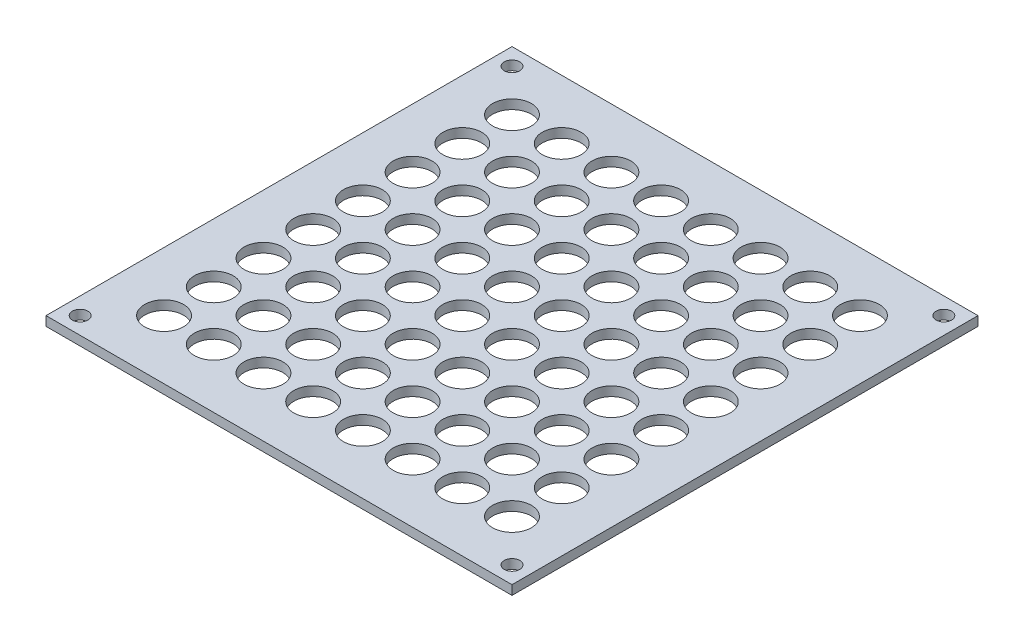
from build123d import *

# Parameters (mm, degrees)
ESBO_O1_W                = 300
ESBO_O1_H                = 300
RESSALTO_EXTRUS_O1_DEPTH = 6
ESBO_O2_R                = 5
CORTE_EXTRUS_O1_DEPTH    = 213.216870206
ESBO_O3_R                = 12.5
CORTE_EXTRUS_O2_DEPTH    = 213.216870206


with BuildPart() as part:
    # Esboço1 → Ressalto-extrusão1 (new body)
    with BuildSketch(Plane(origin=(0, 0, 0), x_dir=(1, 0, 0), z_dir=(0, 1, 0))):
        Rectangle(ESBO_O1_W, ESBO_O1_H)
    extrude(amount=RESSALTO_EXTRUS_O1_DEPTH)

    # Esboço2 → Corte-extrusão1 (cut, through all)
    with BuildSketch(Plane(origin=(0, 6, 0), x_dir=(1, 0, 0), z_dir=(0, 1, 0))):
        with Locations(Location((-139, 139, 0), (0, 0, 270))):
            Circle(ESBO_O2_R)
        with Locations(Location((139, 139, 0), (0, 0, 270))):
            Circle(ESBO_O2_R)
        with Locations(Location((139, -139, 0), (0, 0, 270))):
            Circle(ESBO_O2_R)
        with Locations(Location((-139, -139, 0), (0, 0, 270))):
            Circle(ESBO_O2_R)
    extrude(amount=-CORTE_EXTRUS_O1_DEPTH, mode=Mode.SUBTRACT)

    # Esboço3 → Corte-extrusão2 (cut, through all)
    with BuildSketch(Plane(origin=(0, 6, 0), x_dir=(1, 0, 0), z_dir=(0, 1, 0))):
        with Locations(Location((-112, -112, 0), (0, 0, 270))):
            Circle(ESBO_O3_R)
        with Locations(Location((-80, -112, 0), (0, 0, 90))):
            Circle(ESBO_O3_R)
        with Locations(Location((-48, -112, 0), (0, 0, 270))):
            Circle(ESBO_O3_R)
        with Locations(Location((-16, -112, 0), (0, 0, 90))):
            Circle(ESBO_O3_R)
        with Locations(Location((16, -112, 0), (0, 0, 270))):
            Circle(ESBO_O3_R)
        with Locations(Location((48, -112, 0), (0, 0, 90))):
            Circle(ESBO_O3_R)
        with Locations(Location((80, -112, 0), (0, 0, 270))):
            Circle(ESBO_O3_R)
        with Locations(Location((112, -112, 0), (0, 0, 90))):
            Circle(ESBO_O3_R)
        with Locations(Location((112, -80, 0), (0, 0, 270))):
            Circle(ESBO_O3_R)
        with Locations(Location((80, -80, 0), (0, 0, 90))):
            Circle(ESBO_O3_R)
        with Locations(Location((48, -80, 0), (0, 0, 270))):
            Circle(ESBO_O3_R)
        with Locations(Location((16, -80, 0), (0, 0, 90))):
            Circle(ESBO_O3_R)
        with Locations(Location((-16, -80, 0), (0, 0, 270))):
            Circle(ESBO_O3_R)
        with Locations(Location((-48, -80, 0), (0, 0, 90))):
            Circle(ESBO_O3_R)
        with Locations(Location((-80, -80, 0), (0, 0, 270))):
            Circle(ESBO_O3_R)
        with Locations(Location((-112, -80, 0), (0, 0, 90))):
            Circle(ESBO_O3_R)
        with Locations(Location((112, -16, 0), (0, 0, 270))):
            Circle(ESBO_O3_R)
        with Locations(Location((112, -48, 0), (0, 0, 90))):
            Circle(ESBO_O3_R)
        with Locations(Location((80, -16, 0), (0, 0, 90))):
            Circle(ESBO_O3_R)
        with Locations(Location((80, -48, 0), (0, 0, 270))):
            Circle(ESBO_O3_R)
        with Locations(Location((48, -16, 0), (0, 0, 270))):
            Circle(ESBO_O3_R)
        with Locations(Location((48, -48, 0), (0, 0, 90))):
            Circle(ESBO_O3_R)
        with Locations(Location((16, -16, 0), (0, 0, 90))):
            Circle(ESBO_O3_R)
        with Locations(Location((16, -48, 0), (0, 0, 270))):
            Circle(ESBO_O3_R)
        with Locations(Location((-16, -16, 0), (0, 0, 270))):
            Circle(ESBO_O3_R)
        with Locations(Location((-16, -48, 0), (0, 0, 90))):
            Circle(ESBO_O3_R)
        with Locations(Location((-48, -16, 0), (0, 0, 90))):
            Circle(ESBO_O3_R)
        with Locations(Location((-48, -48, 0), (0, 0, 270))):
            Circle(ESBO_O3_R)
        with Locations(Location((-80, -16, 0), (0, 0, 270))):
            Circle(ESBO_O3_R)
        with Locations(Location((-80, -48, 0), (0, 0, 90))):
            Circle(ESBO_O3_R)
        with Locations(Location((-112, -48, 0), (0, 0, 270))):
            Circle(ESBO_O3_R)
        with Locations(Location((-112, -16, 0), (0, 0, 90))):
            Circle(ESBO_O3_R)
        with Locations(Location((-112, 16, 0), (0, 0, 270))):
            Circle(ESBO_O3_R)
        with Locations(Location((-80, 16, 0), (0, 0, 90))):
            Circle(ESBO_O3_R)
        with Locations(Location((-48, 16, 0), (0, 0, 270))):
            Circle(ESBO_O3_R)
        with Locations(Location((-16, 16, 0), (0, 0, 90))):
            Circle(ESBO_O3_R)
        with Locations(Location((16, 16, 0), (0, 0, 270))):
            Circle(ESBO_O3_R)
        with Locations(Location((48, 16, 0), (0, 0, 90))):
            Circle(ESBO_O3_R)
        with Locations(Location((80, 16, 0), (0, 0, 270))):
            Circle(ESBO_O3_R)
        with Locations(Location((112, 16, 0), (0, 0, 90))):
            Circle(ESBO_O3_R)
        with Locations(Location((112, 48, 0), (0, 0, 270))):
            Circle(ESBO_O3_R)
        with Locations(Location((80, 48, 0), (0, 0, 90))):
            Circle(ESBO_O3_R)
        with Locations(Location((48, 48, 0), (0, 0, 270))):
            Circle(ESBO_O3_R)
        with Locations(Location((16, 48, 0), (0, 0, 90))):
            Circle(ESBO_O3_R)
        with Locations(Location((-16, 48, 0), (0, 0, 270))):
            Circle(ESBO_O3_R)
        with Locations(Location((-48, 48, 0), (0, 0, 90))):
            Circle(ESBO_O3_R)
        with Locations(Location((-80, 48, 0), (0, 0, 270))):
            Circle(ESBO_O3_R)
        with Locations(Location((-112, 48, 0), (0, 0, 90))):
            Circle(ESBO_O3_R)
        with Locations(Location((-112, 80, 0), (0, 0, 270))):
            Circle(ESBO_O3_R)
        with Locations(Location((-80, 80, 0), (0, 0, 90))):
            Circle(ESBO_O3_R)
        with Locations(Location((-48, 80, 0), (0, 0, 270))):
            Circle(ESBO_O3_R)
        with Locations(Location((-16, 80, 0), (0, 0, 90))):
            Circle(ESBO_O3_R)
        with Locations(Location((16, 80, 0), (0, 0, 270))):
            Circle(ESBO_O3_R)
        with Locations(Location((48, 80, 0), (0, 0, 90))):
            Circle(ESBO_O3_R)
        with Locations(Location((80, 80, 0), (0, 0, 270))):
            Circle(ESBO_O3_R)
        with Locations(Location((112, 80, 0), (0, 0, 90))):
            Circle(ESBO_O3_R)
        with Locations(Location((112, 112, 0), (0, 0, 270))):
            Circle(ESBO_O3_R)
        with Locations(Location((80, 112, 0), (0, 0, 90))):
            Circle(ESBO_O3_R)
        with Locations(Location((48, 112, 0), (0, 0, 270))):
            Circle(ESBO_O3_R)
        with Locations(Location((16, 112, 0), (0, 0, 90))):
            Circle(ESBO_O3_R)
        with Locations(Location((-16, 112, 0), (0, 0, 270))):
            Circle(ESBO_O3_R)
        with Locations(Location((-48, 112, 0), (0, 0, 90))):
            Circle(ESBO_O3_R)
        with Locations(Location((-80, 112, 0), (0, 0, 270))):
            Circle(ESBO_O3_R)
        with Locations(Location((-112, 112, 0), (0, 0, 90))):
            Circle(ESBO_O3_R)
    extrude(amount=-CORTE_EXTRUS_O2_DEPTH, mode=Mode.SUBTRACT)


solid = part.part
